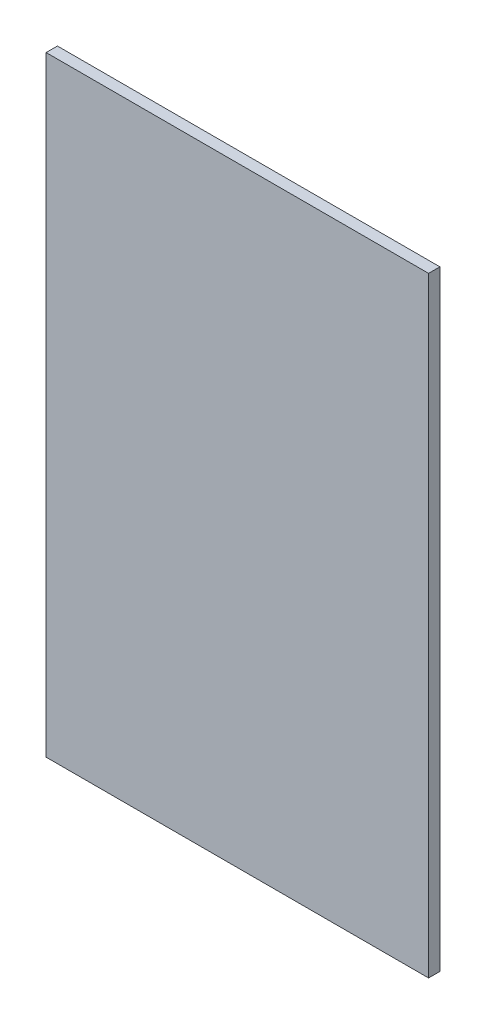
from build123d import *

# Parameters (mm, degrees)
SKETCH1_W           = 33.8
SKETCH1_H           = 53.927991673
BOSS_EXTRUDE1_DEPTH = 1


with BuildPart() as part:
    # Sketch1 → Boss-Extrude1 (new body)
    with BuildSketch(Plane.XY):
        with Locations((17.998029185, -61.974353767)):
            Rectangle(SKETCH1_W, SKETCH1_H)
    extrude(amount=BOSS_EXTRUDE1_DEPTH)


solid = part.part
